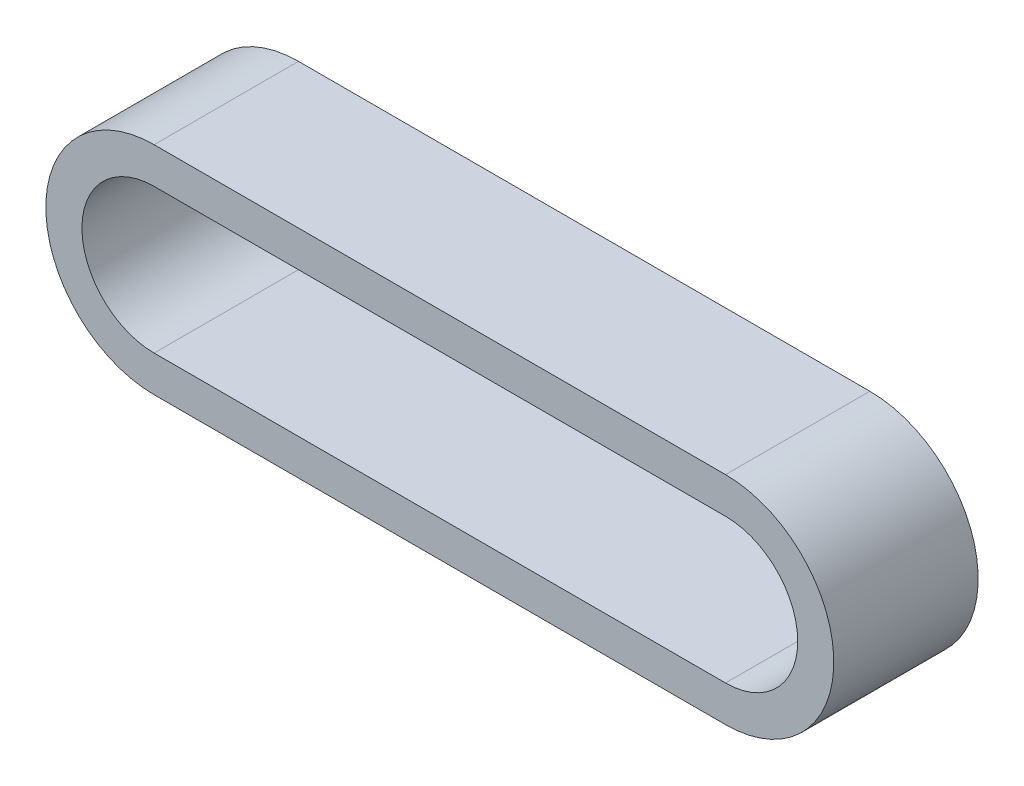
from build123d import *

# Parameters (mm, degrees)
EXTRUDE_1_DEPTH = 6


with BuildPart() as part:
    # 草图1 → 凸台-拉伸1 (new body)
    with BuildSketch(Plane.XY):
        with BuildLine():
            Line((0, 4.5), (23.75, 4.5))
            ThreePointArc((23.75, 4.5), (28.25, 0), (23.75, -4.5))
            Line((23.75, -4.5), (0, -4.5))
            ThreePointArc((0, -4.5), (-4.5, 0), (0, 4.5))
        make_face()
        with BuildLine():
            Line((0, 3), (23.75, 3))
            ThreePointArc((23.75, 3), (26.75, 0), (23.75, -3))
            Line((23.75, -3), (0, -3))
            ThreePointArc((0, -3), (-3, 0), (0, 3))
        make_face(mode=Mode.SUBTRACT)
    extrude(amount=EXTRUDE_1_DEPTH)


solid = part.part
